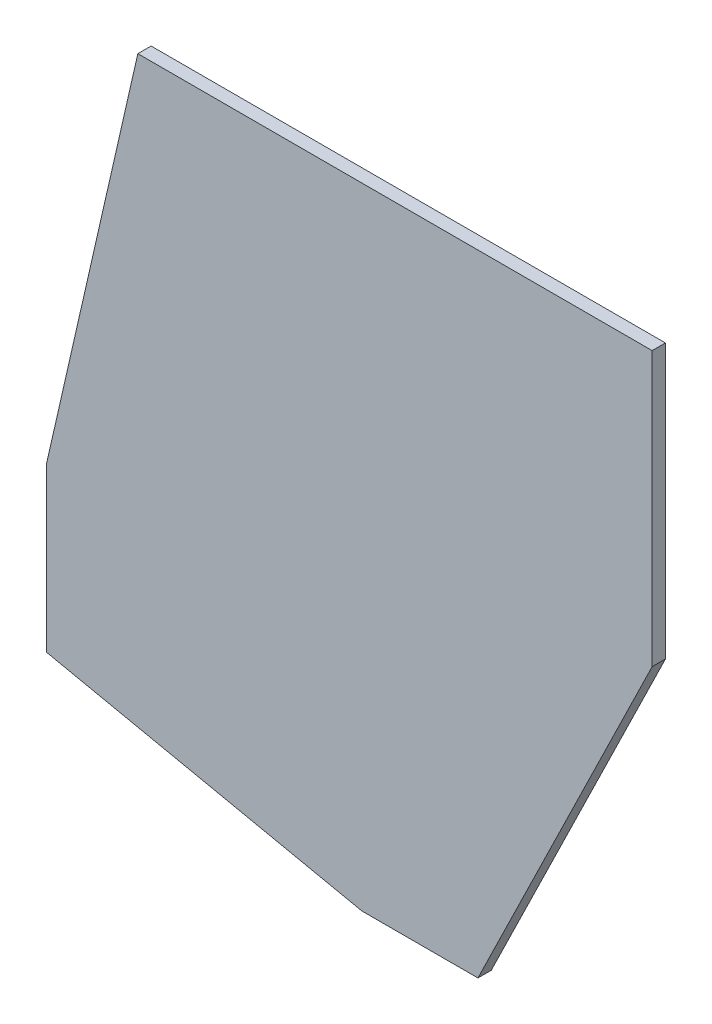
from build123d import *

# Parameters (mm, degrees)
EXTRUDE_1381_DEPTH = 16


with BuildPart() as part:
    # 草图1 → Extrude 1381 (new body)
    with BuildSketch(Plane.XY):
        Polygon((730, -330), (520, -760), (380, -760), (0, -680), (0, -482.786642105), (110, 0), (730, 0), align=None)
    extrude(amount=EXTRUDE_1381_DEPTH)


solid = part.part
